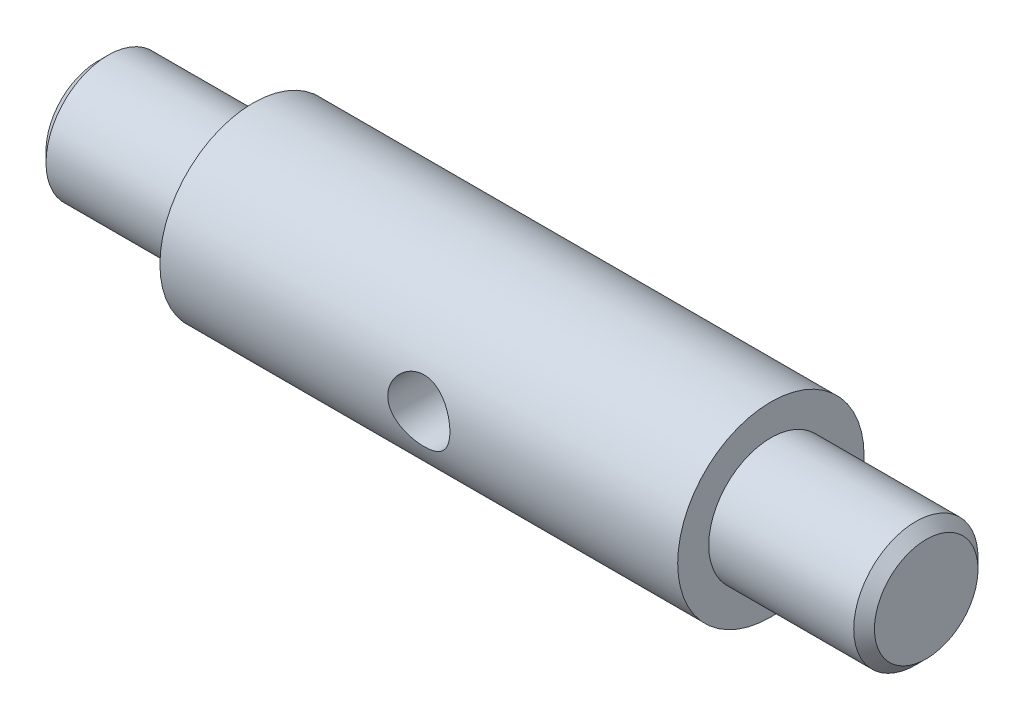
from build123d import *

# Parameters (mm, degrees)
CUT_EXTRUDE1_DEPTH        = 42.976183724
CUT_EXTRUDE1_DEPTH_BACK   = 42.976183724
SKETCH2_R                 = 3
F_6_0MM_DOWEL_HOLE1_D     = 6
F_6_0MM_DOWEL_HOLE1_DEPTH = 45
F_6_0MM_DOWEL_HOLE1_TIP   = 1.732050808
CHAMFER1_SIZE             = 1


with BuildPart() as part:
    # Sketch1 → Revolve1 (revolve)
    with BuildSketch(Plane.XY, mode=Mode.PRIVATE) as revolve1_sk:
        Polygon((-40, 0), (-40, 6), (-25, 6), (-25, 9), (25, 9), (25, 6), (40, 6), (40, 0), align=None)
    revolve(revolve1_sk.sketch.rotate(Axis((0, 0, 0), (1, 0, 0)), 90), axis=Axis((0, 0, 0), (1, 0, 0)))

    # Sketch2 → Cut-Extrude1 (cut, two sides: drawn at the far end of the back side and taken through both)
    with BuildSketch(Plane.XY.offset(-CUT_EXTRUDE1_DEPTH_BACK)):
        Circle(SKETCH2_R)
    extrude(amount=CUT_EXTRUDE1_DEPTH + CUT_EXTRUDE1_DEPTH_BACK, mode=Mode.SUBTRACT)

    # Ø6.0mm Dowel Hole1
    with Locations(Plane.ZY.offset(40)):
        with Locations((0, 0)):
            Hole(F_6_0MM_DOWEL_HOLE1_D / 2, depth=F_6_0MM_DOWEL_HOLE1_DEPTH)
            with Locations((0, 0, -(F_6_0MM_DOWEL_HOLE1_DEPTH + F_6_0MM_DOWEL_HOLE1_TIP / 2))):  # 120° drill point
                Cone(0, F_6_0MM_DOWEL_HOLE1_D / 2, F_6_0MM_DOWEL_HOLE1_TIP, mode=Mode.SUBTRACT)

    # Chamfer1
    chamfer1_edges = [part.edges().sort_by_distance(p)[0] for p in [
        (40, 0, -6),
        (-40, 0, -6),
    ]]
    chamfer(chamfer1_edges, length=CHAMFER1_SIZE)


solid = part.part
